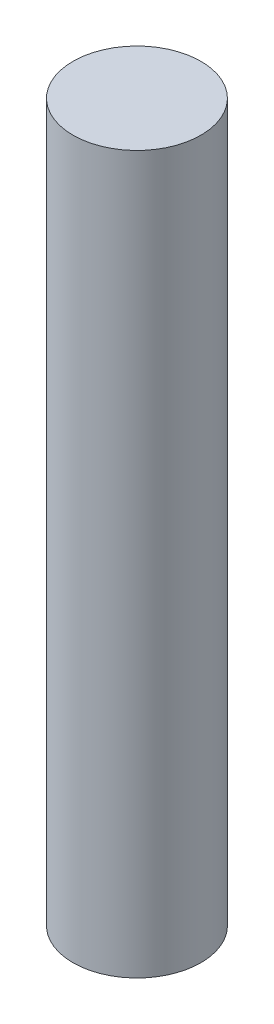
from build123d import *

# Parameters (mm, degrees)
SKETCH1_R           = 1.5875
BOSS_EXTRUDE1_DEPTH = 17.78


with BuildPart() as part:
    # Sketch1 → Boss-Extrude1 (new body)
    with BuildSketch(Plane(origin=(0, 0, 0), x_dir=(1, 0, 0), z_dir=(0, 1, 0))):
        with Locations(Location((0, 0, 0), (0, 0, 270))):
            Circle(SKETCH1_R)
    extrude(amount=BOSS_EXTRUDE1_DEPTH)


solid = part.part
